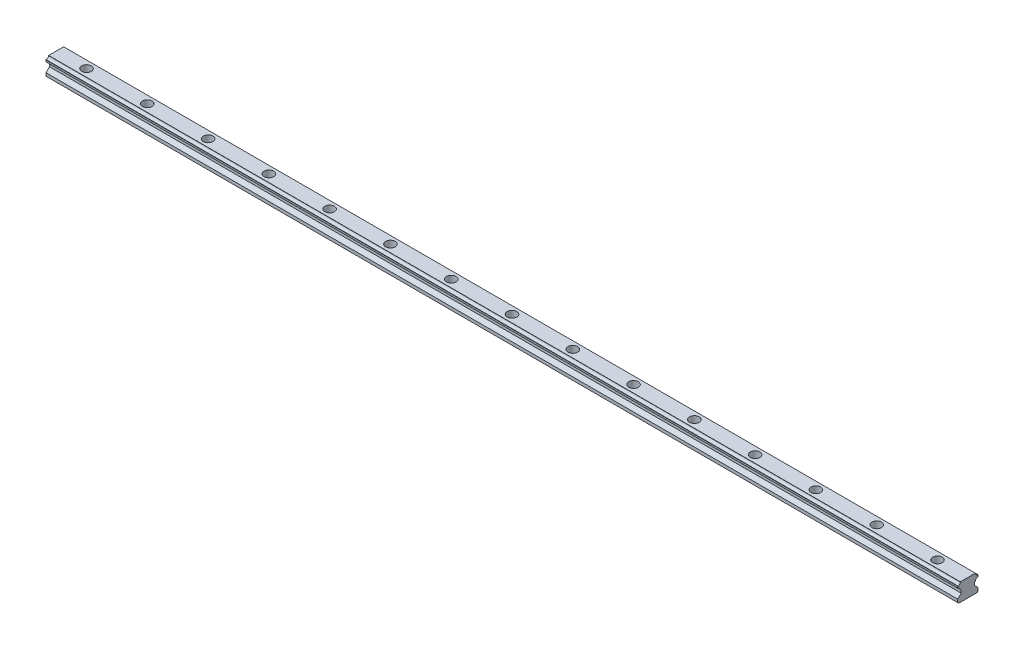
from build123d import *

# Parameters (mm, degrees)
EXTRUDE_1_DEPTH                  = 450
HOLE_WIZARD_M6_78051_D           = 6
HOLE_WIZARD_M6_78051_CBORE_D     = 9.5
HOLE_WIZARD_M6_78051_CBORE_DEPTH = 8.5
PATTERN_LINEAR_1_COUNT           = 8
PATTERN_LINEAR_1_PITCH           = 60
PATTERN_LINEAR_2_COUNT           = 8
PATTERN_LINEAR_2_PITCH           = 60


with BuildPart() as part:
    # Эскиз1 → Бобышка-Вытянуть1 (new, symmetric)
    with BuildSketch(Plane(origin=(0, 0, 0), x_dir=(0, 0, -1), z_dir=(1, 0, 0))):
        with BuildLine():
            Line((-10, 0.989949494), (-9.010050506, 0))
            Line((-9.010050506, 0), (9.010050506, 0))
            Line((9.010050506, 0), (10, 0.989949494))
            Line((10, 0.989949494), (10, 4))
            Line((10, 4), (6.6, 7.4))
            Line((6.6, 7.4), (6.6, 9.9))
            Line((6.6, 9.9), (7.5, 10.8))
            ThreePointArc((7.5, 10.8), (8.173654403, 12.426345597), (9.8, 13.1))
            Line((9.8, 13.1), (10, 13.3))
            Line((10, 13.3), (10, 14.9))
            Line((10, 14.9), (9.8, 15.1))
            ThreePointArc((9.8, 15.1), (8.173654403, 15.773654403), (7.5, 17.4))
            Line((7.5, 17.4), (7.4, 17.5))
            Line((7.4, 17.5), (-7.4, 17.5))
            Line((-7.4, 17.5), (-7.5, 17.4))
            ThreePointArc((-7.5, 17.4), (-8.173654403, 15.773654403), (-9.8, 15.1))
            Line((-9.8, 15.1), (-10, 14.9))
            Line((-10, 14.9), (-10, 13.3))
            Line((-10, 13.3), (-9.8, 13.1))
            ThreePointArc((-9.8, 13.1), (-8.173654403, 12.426345597), (-7.5, 10.8))
            Line((-7.5, 10.8), (-6.6, 9.9))
            Line((-6.6, 9.9), (-6.6, 7.4))
            Line((-6.6, 7.4), (-10, 4))
            Line((-10, 4), (-10, 0.989949494))
        make_face()
    extrude(amount=EXTRUDE_1_DEPTH, both=True)

    # Цековка M6 для болта с шестигранной головкой класса А ГОСТ 78051 (through all)
    with Locations(Plane.ZX.offset(17.5)):
        with Locations((0, 0)):
            hole_wizard_m6_78051 = CounterBoreHole(HOLE_WIZARD_M6_78051_D / 2, HOLE_WIZARD_M6_78051_CBORE_D / 2, HOLE_WIZARD_M6_78051_CBORE_DEPTH)

    # Линейный массив1: Цековка M6 для болта с шестигранной головкой класса А ГОСТ 78051 ×8
    with Locations(*[(i * PATTERN_LINEAR_1_PITCH, 0, 0) for i in range(1, PATTERN_LINEAR_1_COUNT)]):
        add(hole_wizard_m6_78051, mode=Mode.SUBTRACT)

    # Линейный массив2: Цековка M6 для болта с шестигранной головкой класса А ГОСТ 78051 ×8
    with Locations(*[(-i * PATTERN_LINEAR_2_PITCH, 0, 0) for i in range(1, PATTERN_LINEAR_2_COUNT)]):
        add(hole_wizard_m6_78051, mode=Mode.SUBTRACT)


solid = part.part
